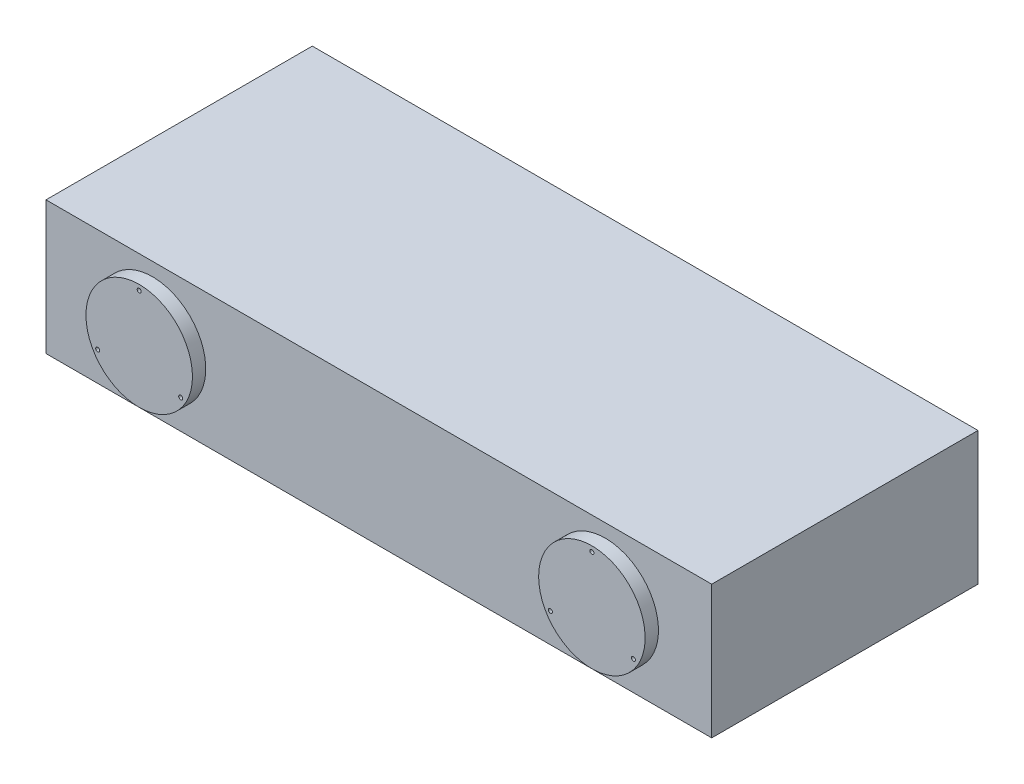
from build123d import *

# Parameters (mm, degrees)
SKETCH1_W               = 500
SKETCH1_H               = 200
BOSS_EXTRUDE1_DEPTH     = 100
SKETCH2_R               = 40
BOSS_EXTRUDE2_DEPTH     = 10
SKETCH5_R               = 1.5
CUT_EXTRUDE3_DEPTH      = 20
CIRPATTERN2_COUNT       = 3
MIRROR4_COPY_1_SKETCH_R = 1.5
MIRROR4_COPY_1_DEPTH    = 20
MIRROR4_COPY_2_SKETCH_R = 1.5
MIRROR4_COPY_2_DEPTH    = 20
MIRROR5_COPY_1_SKETCH_R = 1.5
MIRROR5_COPY_1_DEPTH    = 20
MIRROR5_COPY_2_SKETCH_R = 1.5
MIRROR5_COPY_2_DEPTH    = 20
MIRROR5_COPY_3_SKETCH_R = 40
MIRROR5_COPY_3_DEPTH    = 10
MIRROR5_COPY_4_SKETCH_R = 1.5
MIRROR5_COPY_4_DEPTH    = 20
MIRROR5_COPY_5_SKETCH_R = 1.5
MIRROR5_COPY_5_DEPTH    = 20
MIRROR5_COPY_6_SKETCH_R = 1.5
MIRROR5_COPY_6_DEPTH    = 20


with BuildPart() as part:
    # Sketch1 → Boss-Extrude1 (new body)
    with BuildSketch(Plane(origin=(0, 0, 0), x_dir=(1, 0, 0), z_dir=(0, 1, 0))):
        Rectangle(SKETCH1_W, SKETCH1_H)
    extrude(amount=BOSS_EXTRUDE1_DEPTH)

    # Sketch2 → Boss-Extrude2 (add)
    with BuildSketch(Plane.XY.offset(100)):
        with Locations(Location((-170, 50, 0), (0, 0, 180))):
            Circle(SKETCH2_R)
    boss_extrude2 = extrude(amount=BOSS_EXTRUDE2_DEPTH)

    # Sketch5 → Cut-Extrude3 (cut)
    with BuildSketch(Plane.XY.offset(110)):
        with Locations((-170, 86)):
            Circle(SKETCH5_R)
    cut_extrude3 = extrude(amount=-CUT_EXTRUDE3_DEPTH, mode=Mode.SUBTRACT)

    # CirPattern2: Cut-Extrude3 ×3 about axis
    cirpattern2_axis = Axis((-170, 50, 0), (0, 0, 1))
    for i in range(1, CIRPATTERN2_COUNT):
        add(cut_extrude3.rotate(cirpattern2_axis, i * 360 / CIRPATTERN2_COUNT), mode=Mode.SUBTRACT)

    # Mirror4: Boss-Extrude2, Cut-Extrude3 across plane
    add(boss_extrude2.mirror(Plane(origin=(0, 0, 0), x_dir=(0, 0, 1), z_dir=(1, 0, 0))))
    add(cut_extrude3.mirror(Plane(origin=(0, 0, 0), x_dir=(0, 0, 1), z_dir=(1, 0, 0))), mode=Mode.SUBTRACT)

    # Mirror4 copy 1 sketch → Mirror4 copy 1 (cut)
    with BuildSketch(Plane(origin=(211.698729811, 222.224318643, 110), x_dir=(0.4999999999999998, 0.8660254037844387, 0), z_dir=(0, 0, 1))):
        with Locations((-170, -86)):
            Circle(MIRROR4_COPY_1_SKETCH_R)
    extrude(amount=-MIRROR4_COPY_1_DEPTH, mode=Mode.SUBTRACT)

    # Mirror4 copy 2 sketch → Mirror4 copy 2 (cut)
    with BuildSketch(Plane(origin=(298.301270189, -72.224318643, 110), x_dir=(0.5000000000000004, -0.8660254037844384, 0), z_dir=(0, 0, 1))):
        with Locations((-170, -86)):
            Circle(MIRROR4_COPY_2_SKETCH_R)
    extrude(amount=-MIRROR4_COPY_2_DEPTH, mode=Mode.SUBTRACT)

    # Mirror5: Boss-Extrude2, Cut-Extrude3 across plane
    add(boss_extrude2.mirror(Plane.XY))
    add(cut_extrude3.mirror(Plane.XY), mode=Mode.SUBTRACT)

    # Mirror5 copy 1 sketch → Mirror5 copy 1 (cut)
    with BuildSketch(Plane(origin=(-211.698729811, 222.224318643, -110), x_dir=(-0.4999999999999998, 0.8660254037844387, 0), z_dir=(0, 0, -1))):
        with Locations((-170, -86)):
            Circle(MIRROR5_COPY_1_SKETCH_R)
    extrude(amount=-MIRROR5_COPY_1_DEPTH, mode=Mode.SUBTRACT)

    # Mirror5 copy 2 sketch → Mirror5 copy 2 (cut)
    with BuildSketch(Plane(origin=(-298.301270189, -72.224318643, -110), x_dir=(-0.5000000000000004, -0.8660254037844384, 0), z_dir=(0, 0, -1))):
        with Locations((-170, -86)):
            Circle(MIRROR5_COPY_2_SKETCH_R)
    extrude(amount=-MIRROR5_COPY_2_DEPTH, mode=Mode.SUBTRACT)

    # Mirror5 copy 3 sketch → Mirror5 copy 3 (add)
    with BuildSketch(Plane(origin=(0, 0, -100), x_dir=(-1, 0, 0), z_dir=(0, 0, -1))):
        with Locations(Location((-170, 50, 0), (0, 0, 180))):
            Circle(MIRROR5_COPY_3_SKETCH_R)
    extrude(amount=MIRROR5_COPY_3_DEPTH)

    # Mirror5 copy 4 sketch → Mirror5 copy 4 (cut)
    with BuildSketch(Plane(origin=(0, 0, -110), x_dir=(-1, 0, 0), z_dir=(0, 0, -1))):
        with Locations((-170, 86)):
            Circle(MIRROR5_COPY_4_SKETCH_R)
    extrude(amount=-MIRROR5_COPY_4_DEPTH, mode=Mode.SUBTRACT)

    # Mirror5 copy 5 sketch → Mirror5 copy 5 (cut)
    with BuildSketch(Plane(origin=(211.698729811, 222.224318643, -110), x_dir=(0.4999999999999998, 0.8660254037844387, 0), z_dir=(0, 0, -1))):
        with Locations((-170, 86)):
            Circle(MIRROR5_COPY_5_SKETCH_R)
    extrude(amount=-MIRROR5_COPY_5_DEPTH, mode=Mode.SUBTRACT)

    # Mirror5 copy 6 sketch → Mirror5 copy 6 (cut)
    with BuildSketch(Plane(origin=(298.301270189, -72.224318643, -110), x_dir=(0.5000000000000004, -0.8660254037844384, 0), z_dir=(0, 0, -1))):
        with Locations((-170, 86)):
            Circle(MIRROR5_COPY_6_SKETCH_R)
    extrude(amount=-MIRROR5_COPY_6_DEPTH, mode=Mode.SUBTRACT)


solid = part.part
